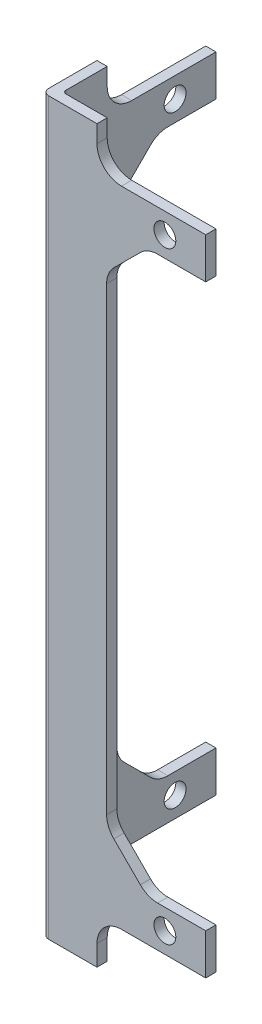
from build123d import *

# Parameters (mm, degrees)
SKETCH1_W            = 25.4
SKETCH1_H            = 25.4
BOSS_EXTRUDE1_DEPTH  = 56.75
SKETCH2_W            = 23.8125
SKETCH2_H            = 23.8125
CUT_EXTRUDE1_DEPTH   = 115.912270885
FILLET1_R            = 0.508
M3_CLEARANCE_HOLE1_D = 3.4
M3_CLEARANCE_HOLE2_D = 3.4
M3_CLEARANCE_HOLE3_D = 3.4
M3_CLEARANCE_HOLE4_D = 3.4
FILLET2_R            = 1
CUT_EXTRUDE2_REACH   = 65.459
SKETCH11_W           = 16.9
SKETCH11_H           = 6.499999954
SKETCH11_H_2         = 7
CUT_EXTRUDE3_REACH   = 65.459
SKETCH12_W           = 16.9
SKETCH12_H           = 6.5
SKETCH12_H_2         = 7
FILLET3_R            = 3.81
CUT_EXTRUDE4_REACH   = 65.459
SKETCH13_W           = 15.4
SKETCH13_H           = 87.3
CUT_EXTRUDE5_REACH   = 65.459
SKETCH14_W           = 15.4
SKETCH14_H           = 87.3
CHAMFER2_SIZE        = 6.35
FILLET5_R            = 3.81


with BuildPart() as part:
    # Sketch1 → Boss-Extrude1 (new, symmetric)
    with BuildSketch(Plane(origin=(0, 0, 0), x_dir=(1, 0, 0), z_dir=(0, 1, 0))):
        Rectangle(SKETCH1_W, SKETCH1_H)
    extrude(amount=BOSS_EXTRUDE1_DEPTH, both=True)

    # Sketch2 → Cut-Extrude1 (cut, through all)
    with BuildSketch(Plane(origin=(0, 56.75, 0), x_dir=(1, 0, 0), z_dir=(0, 1, 0))):
        with Locations((0.79375, 0.79375)):
            Rectangle(SKETCH2_W, SKETCH2_H)
    extrude(amount=-CUT_EXTRUDE1_DEPTH, mode=Mode.SUBTRACT)

    # Fillet1
    fillet1_edges = [part.edges().sort_by_distance(p)[0] for p in [
        (-11.1125, 0, 11.1125),
    ]]
    fillet(fillet1_edges, radius=FILLET1_R)

    # M3 Clearance Hole1 (through all)
    with Locations(Plane.XY.offset(12.7)):
        with Locations((6.35, 47.075)):
            Hole(M3_CLEARANCE_HOLE1_D / 2)

    # M3 Clearance Hole2 (through all)
    with Locations(Plane.ZY.offset(12.7)):
        with Locations((-6.35, 47.075)):
            Hole(M3_CLEARANCE_HOLE2_D / 2)

    # M3 Clearance Hole3 (through all)
    with Locations(Plane.XY.offset(12.7)):
        with Locations((6.35, -46.575)):
            Hole(M3_CLEARANCE_HOLE3_D / 2)

    # M3 Clearance Hole4 (through all)
    with Locations(Plane.ZY.offset(12.7)):
        with Locations((-6.35, -46.575)):
            Hole(M3_CLEARANCE_HOLE4_D / 2)

    # Fillet2
    fillet2_edges = [part.edges().sort_by_distance(p)[0] for p in [
        (-12.7, 0, 12.7),
    ]]
    fillet(fillet2_edges, radius=FILLET2_R)

    # Sketch11 → Cut-Extrude2 (cut, up to next)
    with BuildSketch(Plane.ZY.offset(12.7), mode=Mode.PRIVATE) as cut_extrude2_sk1:
        with Locations((-4.25, 53.500000023)):
            Rectangle(SKETCH11_W, SKETCH11_H)
    cut_extrude2_tool1 = extrude(cut_extrude2_sk1.sketch, amount=-CUT_EXTRUDE2_REACH, mode=Mode.PRIVATE) & part.part
    # Sketch11 → Cut-Extrude2 (cut, up to next)
    with BuildSketch(Plane.ZY.offset(12.7), mode=Mode.PRIVATE) as cut_extrude2_sk2:
        with Locations((-4.25, -53.25)):
            Rectangle(SKETCH11_W, SKETCH11_H_2)
    cut_extrude2_tool2 = extrude(cut_extrude2_sk2.sketch, amount=-CUT_EXTRUDE2_REACH, mode=Mode.PRIVATE) & part.part
    add(cut_extrude2_tool1.solids().sort_by_distance((-12.7, 53.5, -4.25))[0], mode=Mode.SUBTRACT)
    add(cut_extrude2_tool2.solids().sort_by_distance((-12.7, -53.25, -4.25))[0], mode=Mode.SUBTRACT)

    # Sketch12 → Cut-Extrude3 (cut, up to next)
    with BuildSketch(Plane.XY.offset(12.7), mode=Mode.PRIVATE) as cut_extrude3_sk1:
        with Locations((4.25, 53.5)):
            Rectangle(SKETCH12_W, SKETCH12_H)
    cut_extrude3_tool1 = extrude(cut_extrude3_sk1.sketch, amount=-CUT_EXTRUDE3_REACH, mode=Mode.PRIVATE) & part.part
    # Sketch12 → Cut-Extrude3 (cut, up to next)
    with BuildSketch(Plane.XY.offset(12.7), mode=Mode.PRIVATE) as cut_extrude3_sk2:
        with Locations((4.25, -53.25)):
            Rectangle(SKETCH12_W, SKETCH12_H_2)
    cut_extrude3_tool2 = extrude(cut_extrude3_sk2.sketch, amount=-CUT_EXTRUDE3_REACH, mode=Mode.PRIVATE) & part.part
    add(cut_extrude3_tool1.solids().sort_by_distance((4.25, 53.5, 12.7))[0], mode=Mode.SUBTRACT)
    add(cut_extrude3_tool2.solids().sort_by_distance((4.25, -53.25, 12.7))[0], mode=Mode.SUBTRACT)

    # Fillet3
    fillet3_edges = [part.edges().sort_by_distance(p)[0] for p in [
        (-4.2, 50.25, 11.90625),
        (-4.2, -49.75, 11.90625),
        (-11.90625, 50.250000046, 4.2),
        (-11.90625, -49.75, 4.2),
    ]]
    fillet(fillet3_edges, radius=FILLET3_R)

    # Sketch13 → Cut-Extrude4 (cut, up to next)
    with BuildSketch(Plane.ZY.offset(12.7), mode=Mode.PRIVATE) as cut_extrude4_sk1:
        with Locations((-5, 0.25)):
            Rectangle(SKETCH13_W, SKETCH13_H)
    cut_extrude4_tool1 = extrude(cut_extrude4_sk1.sketch, amount=-CUT_EXTRUDE4_REACH, mode=Mode.PRIVATE) & part.part
    add(cut_extrude4_tool1.solids().sort_by_distance((-12.7, 0.25, -5))[0], mode=Mode.SUBTRACT)

    # Sketch14 → Cut-Extrude5 (cut, up to next)
    with BuildSketch(Plane.XY.offset(12.7), mode=Mode.PRIVATE) as cut_extrude5_sk1:
        with Locations((5, 0.25)):
            Rectangle(SKETCH14_W, SKETCH14_H)
    cut_extrude5_tool1 = extrude(cut_extrude5_sk1.sketch, amount=-CUT_EXTRUDE5_REACH, mode=Mode.PRIVATE) & part.part
    add(cut_extrude5_tool1.solids().sort_by_distance((5, 0.25, 12.7))[0], mode=Mode.SUBTRACT)

    # Chamfer2
    chamfer2_edges = [part.edges().sort_by_distance(p)[0] for p in [
        (-11.90625, 43.9, 2.7),
        (-11.90625, -43.4, 2.7),
        (-2.7, -43.4, 11.90625),
        (-2.7, 43.9, 11.90625),
    ]]
    chamfer(chamfer2_edges, length=CHAMFER2_SIZE)

    # Fillet5
    fillet5_edges = [part.edges().sort_by_distance(p)[0] for p in [
        (-11.90625, 43.9, -3.65),
        (-11.90625, -37.05, 2.7),
        (-11.90625, 37.55, 2.7),
        (-2.7, -37.05, 11.90625),
        (-2.7, 37.55, 11.90625),
        (3.65, 43.9, 11.90625),
        (3.65, -43.4, 11.90625),
        (-11.90625, -43.4, -3.65),
    ]]
    fillet(fillet5_edges, radius=FILLET5_R)


solid = part.part
